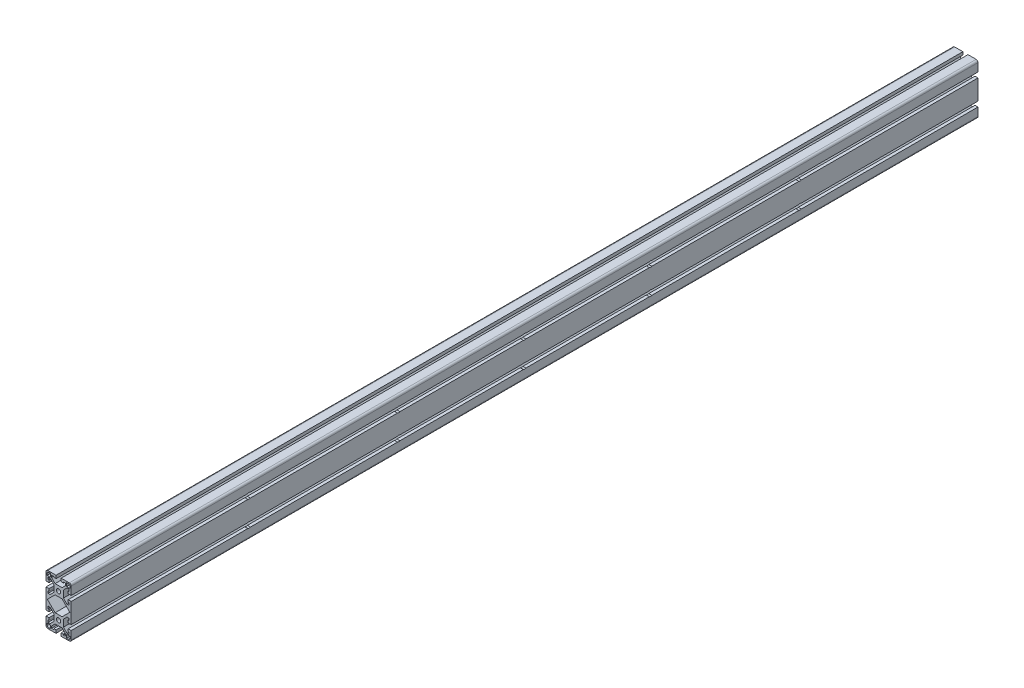
from build123d import *

# Parameters (mm, degrees)
SKETCH2_R                            = 3.35
F_40_SERIES_TS40_80LM_650037_2_DEPTH = 1440
M8X1_25_TAPPED_HOLE1_D               = 6.8
M8X1_25_TAPPED_HOLE1_DEPTH           = 30
M8X1_25_TAPPED_HOLE1_TIP             = 2.042926105
M8X1_25_TAPPED_HOLE2_D               = 6.8
M8X1_25_TAPPED_HOLE2_DEPTH           = 30
M8X1_25_TAPPED_HOLE2_TIP             = 2.042926105
M8_CLEARANCE_HOLE1_D                 = 9
M8_CLEARANCE_HOLE2_D                 = 9


with BuildPart() as part:
    # Sketch2 → 40 series TS40-80LM-650037(2) (new body)
    with BuildSketch(Plane.XY.offset(-720)):
        with BuildLine():
            Line((0, -27.681), (-5.525738531, -27.681))
            Line((-5.525738531, -27.681), (-11.176, -33.331261469))
            Line((-11.176, -33.331261469), (-11.176, -36.6218))
            Line((-11.176, -36.6218), (-7.6835, -36.6218))
            Line((-7.6835, -36.6218), (-7.6835, -35.2248))
            Line((-7.6835, -35.2248), (-4.0488, -35.2248))
            Line((-4.0488, -35.2248), (-4.0488, -40))
            Line((-4.0488, -40), (-17, -40))
            ThreePointArc((-17, -40), (-19.121320344, -39.121320344), (-20, -37))
            Line((-20, -37), (-20, -24.0488))
            Line((-20, -24.0488), (-15.2248, -24.0488))
            Line((-15.2248, -24.0488), (-15.2248, -27.6835))
            Line((-15.2248, -27.6835), (-16.6218, -27.6835))
            Line((-16.6218, -27.6835), (-16.6218, -31.176))
            Line((-16.6218, -31.176), (-13.331261469, -31.176))
            Line((-13.331261469, -31.176), (-7.681, -25.525738531))
            Line((-7.681, -25.525738531), (-7.681, -20))
            Line((-7.681, -20), (-7.681, -14.474261469))
            Line((-7.681, -14.474261469), (-13.331261469, -8.824))
            Line((-13.331261469, -8.824), (-16.6218, -8.824))
            Line((-16.6218, -8.824), (-16.6218, -12.3165))
            Line((-16.6218, -12.3165), (-15.2248, -12.3165))
            Line((-15.2248, -12.3165), (-15.2248, -15.9512))
            Line((-15.2248, -15.9512), (-20, -15.9512))
            Line((-20, -15.9512), (-20, 15.9512))
            Line((-20, 15.9512), (-15.2248, 15.9512))
            Line((-15.2248, 15.9512), (-15.2248, 12.3165))
            Line((-15.2248, 12.3165), (-16.6218, 12.3165))
            Line((-16.6218, 12.3165), (-16.6218, 8.824))
            Line((-16.6218, 8.824), (-13.331261469, 8.824))
            Line((-13.331261469, 8.824), (-7.681, 14.474261469))
            Line((-7.681, 14.474261469), (-7.681, 25.525738531))
            Line((-7.681, 25.525738531), (-13.331261469, 31.176))
            Line((-13.331261469, 31.176), (-16.6218, 31.176))
            Line((-16.6218, 31.176), (-16.6218, 27.6835))
            Line((-16.6218, 27.6835), (-15.2248, 27.6835))
            Line((-15.2248, 27.6835), (-15.2248, 24.0488))
            Line((-15.2248, 24.0488), (-20, 24.0488))
            Line((-20, 24.0488), (-20, 37))
            ThreePointArc((-20, 37), (-19.121320344, 39.121320344), (-17, 40))
            Line((-17, 40), (-4.0488, 40))
            Line((-4.0488, 40), (-4.0488, 35.2248))
            Line((-4.0488, 35.2248), (-7.6835, 35.2248))
            Line((-7.6835, 35.2248), (-7.6835, 36.6218))
            Line((-7.6835, 36.6218), (-11.176, 36.6218))
            Line((-11.176, 36.6218), (-11.176, 33.331261469))
            Line((-11.176, 33.331261469), (-5.525738531, 27.681))
            Line((-5.525738531, 27.681), (0, 27.681))
            Line((0, 27.681), (5.525738531, 27.681))
            Line((5.525738531, 27.681), (11.176, 33.331261469))
            Line((11.176, 33.331261469), (11.176, 36.6218))
            Line((11.176, 36.6218), (7.6835, 36.6218))
            Line((7.6835, 36.6218), (7.6835, 35.2248))
            Line((7.6835, 35.2248), (4.0488, 35.2248))
            Line((4.0488, 35.2248), (4.0488, 40))
            Line((4.0488, 40), (17, 40))
            ThreePointArc((17, 40), (19.121320344, 39.121320344), (20, 37))
            Line((20, 37), (20, 24.0488))
            Line((20, 24.0488), (15.2248, 24.0488))
            Line((15.2248, 24.0488), (15.2248, 27.6835))
            Line((15.2248, 27.6835), (16.6218, 27.6835))
            Line((16.6218, 27.6835), (16.6218, 31.176))
            Line((16.6218, 31.176), (13.331261469, 31.176))
            Line((13.331261469, 31.176), (7.681, 25.525738531))
            Line((7.681, 25.525738531), (7.681, 20))
            Line((7.681, 20), (7.681, 14.474261469))
            Line((7.681, 14.474261469), (13.331261469, 8.824))
            Line((13.331261469, 8.824), (16.6218, 8.824))
            Line((16.6218, 8.824), (16.6218, 12.3165))
            Line((16.6218, 12.3165), (15.2248, 12.3165))
            Line((15.2248, 12.3165), (15.2248, 15.9512))
            Line((15.2248, 15.9512), (20, 15.9512))
            Line((20, 15.9512), (20, -15.9512))
            Line((20, -15.9512), (15.2248, -15.9512))
            Line((15.2248, -15.9512), (15.2248, -12.3165))
            Line((15.2248, -12.3165), (16.6218, -12.3165))
            Line((16.6218, -12.3165), (16.6218, -8.824))
            Line((16.6218, -8.824), (13.331261469, -8.824))
            Line((13.331261469, -8.824), (7.681, -14.474261469))
            Line((7.681, -14.474261469), (7.681, -20))
            Line((7.681, -20), (7.681, -25.525738531))
            Line((7.681, -25.525738531), (13.331261469, -31.176))
            Line((13.331261469, -31.176), (16.6218, -31.176))
            Line((16.6218, -31.176), (16.6218, -27.6835))
            Line((16.6218, -27.6835), (15.2248, -27.6835))
            Line((15.2248, -27.6835), (15.2248, -24.0488))
            Line((15.2248, -24.0488), (20, -24.0488))
            Line((20, -24.0488), (20, -37))
            ThreePointArc((20, -37), (19.121320344, -39.121320344), (17, -40))
            Line((17, -40), (4.0488, -40))
            Line((4.0488, -40), (4.0488, -35.2248))
            Line((4.0488, -35.2248), (7.6835, -35.2248))
            Line((7.6835, -35.2248), (7.6835, -36.6218))
            Line((7.6835, -36.6218), (11.176, -36.6218))
            Line((11.176, -36.6218), (11.176, -33.331261469))
            Line((11.176, -33.331261469), (5.525738531, -27.681))
            Line((5.525738531, -27.681), (0, -27.681))
        make_face()
        with Locations((0, -20)):
            Circle(SKETCH2_R, mode=Mode.SUBTRACT)
        with Locations((0, 20)):
            Circle(SKETCH2_R, mode=Mode.SUBTRACT)
        Polygon((-5.525738531, 12.319), (-17.844738531, 0), (-5.525738531, -12.319), (0, -12.319), (5.525738531, -12.319), (17.844738531, 0), (5.525738531, 12.319), (0, 12.319), align=None, mode=Mode.SUBTRACT)
        with BuildLine():
            Line((12.8372, 38.222), (12.8372, 32.8372))
            Line((12.8372, 32.8372), (18.222, 32.8372))
            Line((18.222, 32.8372), (18.222, 35.428))
            ThreePointArc((18.222, 35.428), (17.403656347, 37.403656347), (15.428, 38.222))
            Line((15.428, 38.222), (12.8372, 38.222))
        make_face(mode=Mode.SUBTRACT)
        with BuildLine():
            Line((12.8372, -32.8372), (18.222, -32.8372))
            Line((18.222, -32.8372), (18.222, -35.428))
            ThreePointArc((18.222, -35.428), (17.403656347, -37.403656347), (15.428, -38.222))
            Line((15.428, -38.222), (12.8372, -38.222))
            Line((12.8372, -38.222), (12.8372, -32.8372))
        make_face(mode=Mode.SUBTRACT)
        with BuildLine():
            Line((-12.8372, -38.222), (-12.8372, -32.8372))
            Line((-12.8372, -32.8372), (-18.222, -32.8372))
            Line((-18.222, -32.8372), (-18.222, -35.428))
            ThreePointArc((-18.222, -35.428), (-17.403656347, -37.403656347), (-15.428, -38.222))
            Line((-15.428, -38.222), (-12.8372, -38.222))
        make_face(mode=Mode.SUBTRACT)
        with BuildLine():
            Line((-18.222, 35.428), (-18.222, 32.8372))
            Line((-18.222, 32.8372), (-12.8372, 32.8372))
            Line((-12.8372, 32.8372), (-12.8372, 38.222))
            Line((-12.8372, 38.222), (-15.428, 38.222))
            ThreePointArc((-15.428, 38.222), (-17.403656347, 37.403656347), (-18.222, 35.428))
        make_face(mode=Mode.SUBTRACT)
    extrude(amount=F_40_SERIES_TS40_80LM_650037_2_DEPTH)

    # M8x1.25 Tapped Hole1
    with Locations(Plane.XY.offset(720)):
        with Locations((0, 20), (0, -20)):
            Hole(M8X1_25_TAPPED_HOLE1_D / 2, depth=M8X1_25_TAPPED_HOLE1_DEPTH)
            with Locations((0, 0, -(M8X1_25_TAPPED_HOLE1_DEPTH + M8X1_25_TAPPED_HOLE1_TIP / 2))):  # 118° drill point
                Cone(0, M8X1_25_TAPPED_HOLE1_D / 2, M8X1_25_TAPPED_HOLE1_TIP, mode=Mode.SUBTRACT)

    # M8x1.25 Tapped Hole2
    with Locations(Plane(origin=(0, 0, -720), x_dir=(-1, 0, 0), z_dir=(0, 0, -1))):
        with Locations((0, 20), (0, -20)):
            Hole(M8X1_25_TAPPED_HOLE2_D / 2, depth=M8X1_25_TAPPED_HOLE2_DEPTH)
            with Locations((0, 0, -(M8X1_25_TAPPED_HOLE2_DEPTH + M8X1_25_TAPPED_HOLE2_TIP / 2))):  # 118° drill point
                Cone(0, M8X1_25_TAPPED_HOLE2_D / 2, M8X1_25_TAPPED_HOLE2_TIP, mode=Mode.SUBTRACT)

    # M8 Clearance Hole1 (through all)
    with Locations(Plane.ZY.offset(20)):
        with Locations((-200, 20), (200, 20), (200, -20), (-200, -20)):
            Hole(M8_CLEARANCE_HOLE1_D / 2)

    # M8 Clearance Hole2 (through all)
    with Locations(Plane.ZY.offset(20)):
        with Locations((-437.5, -20), (437.5, 20), (-437.5, 20), (437.5, -20), (0, -20), (0, 20)):
            Hole(M8_CLEARANCE_HOLE2_D / 2)


solid = part.part
